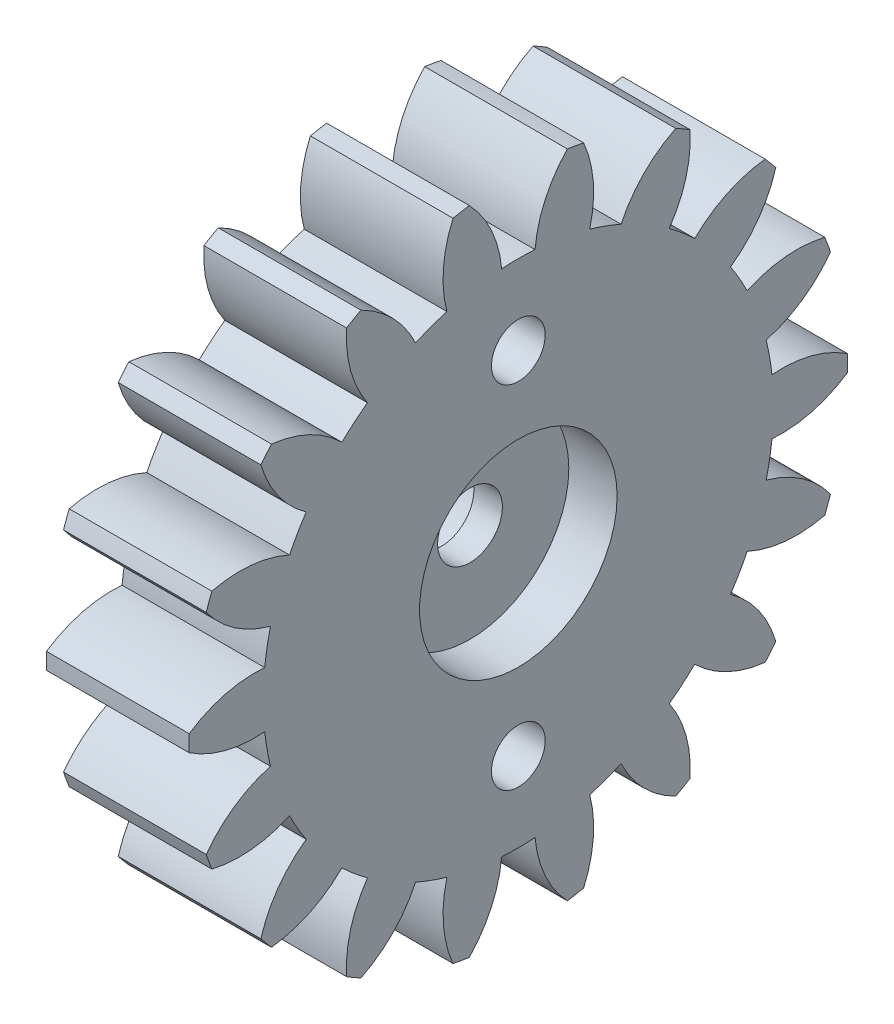
from build123d import *

# Parameters (mm, degrees)
BASPROSKE_W         = 6.5
BASPROSKE_H         = 15
TOOTHCUT_DEPTH      = 23.186707732
TEETHCUTS_COUNT     = 18
TEETHCUTS_ANGLE     = 340
BORSKE_R            = 0.4
BORE_DEPTH          = 50.0000508
SKETCH_1_R          = 4.5
CUT_EXTRUDE_1_DEPTH = 2.2
SKETCH_2_R          = 1.475
CUT_EXTRUDE_2_DEPTH = 22.529170235
SKETCH_3_R          = 1.225
CUT_EXTRUDE_3_DEPTH = 23.074083695
SKETCH_4_R          = 2.15
CUT_EXTRUDE_5_DEPTH = 2.2
SKETCH_5_R          = 2.5
CUT_EXTRUDE_6_DEPTH = 3


with BuildPart() as part:
    # BasProSke → Base-Revolve (revolve)
    with BuildSketch(Plane(origin=(0, 0, 0), x_dir=(1, 0, 0), z_dir=(0, 1, 0)), mode=Mode.PRIVATE) as base_revolve_sk:
        with Locations((3.25, 7.5)):
            Rectangle(BASPROSKE_W, BASPROSKE_H)
    revolve(base_revolve_sk.sketch.rotate(Axis((-10, 0, 0), (1, 0, 0)), 180), axis=Axis((-10, 0, 0), (1, 0, 0)))

    # TooCutSke → ToothCut (cut, through all)
    with BuildSketch(Plane(origin=(0, 0, 0), x_dir=(0, 0, -1), z_dir=(1, 0, 0))):
        with BuildLine():
            ThreePointArc((0.759974923, 11.599129886), (0, 11.624), (-0.759974923, 11.599129886))
            ThreePointArc((-0.759974923, 11.599129886), (-1.229186471, 13.354767823), (-2.254227748, 14.855339189))
            ThreePointArc((-2.254227748, 14.855339189), (0, 15.0254), (2.254227748, 14.855339189))
            ThreePointArc((2.254227748, 14.855339189), (1.229186471, 13.354767823), (0.759974923, 11.599129886))
        make_face()
    toothcut = extrude(amount=TOOTHCUT_DEPTH, mode=Mode.SUBTRACT)

    # TeethCuts: ToothCut ×18 about axis
    teethcuts_axis = Axis((-10, 0, 0), (1, 0, 0))
    for i in range(1, TEETHCUTS_COUNT):
        add(toothcut.rotate(teethcuts_axis, i * TEETHCUTS_ANGLE / (TEETHCUTS_COUNT - 1)), mode=Mode.SUBTRACT)

    # BorSke → Bore (cut, symmetric)
    with BuildSketch(Plane(origin=(0, 0, 0), x_dir=(0, 0, -1), z_dir=(1, 0, 0))):
        with Locations(Location((0, 0, 0), (0, 0, 180))):
            Circle(BORSKE_R)
    extrude(amount=BORE_DEPTH, both=True, mode=Mode.SUBTRACT)

    # 草图1 → 切除-拉伸1 (cut)
    with BuildSketch(Plane(origin=(6.5, 0, 0), x_dir=(0, 0, -1), z_dir=(1, 0, 0))):
        Circle(SKETCH_1_R)
    extrude(amount=-CUT_EXTRUDE_1_DEPTH, mode=Mode.SUBTRACT)

    # 草图2 → 切除-拉伸2 (cut, through all)
    with BuildSketch(Plane(origin=(4.3, 0, 0), x_dir=(0, 0, -1), z_dir=(1, 0, 0))):
        Circle(SKETCH_2_R)
    extrude(amount=-CUT_EXTRUDE_2_DEPTH, mode=Mode.SUBTRACT)

    # 草图3 → 切除-拉伸3 (cut, through all)
    with BuildSketch(Plane(origin=(6.5, 0, 0), x_dir=(0, 0, -1), z_dir=(1, 0, 0))):
        with Locations((0, -8)):
            Circle(SKETCH_3_R)
        with Locations((0, 8)):
            Circle(SKETCH_3_R)
    extrude(amount=-CUT_EXTRUDE_3_DEPTH, mode=Mode.SUBTRACT)

    # 草图4 → 切除-拉伸5 (cut)
    with BuildSketch(Plane.ZY):
        with Locations((0, -8)):
            Circle(SKETCH_4_R)
        with Locations((0, 8)):
            Circle(SKETCH_4_R)
    extrude(amount=-CUT_EXTRUDE_5_DEPTH, mode=Mode.SUBTRACT)

    # 草图5 → 切除-拉伸6 (cut)
    with BuildSketch(Plane.ZY):
        Circle(SKETCH_5_R)
    extrude(amount=-CUT_EXTRUDE_6_DEPTH, mode=Mode.SUBTRACT)


solid = part.part
